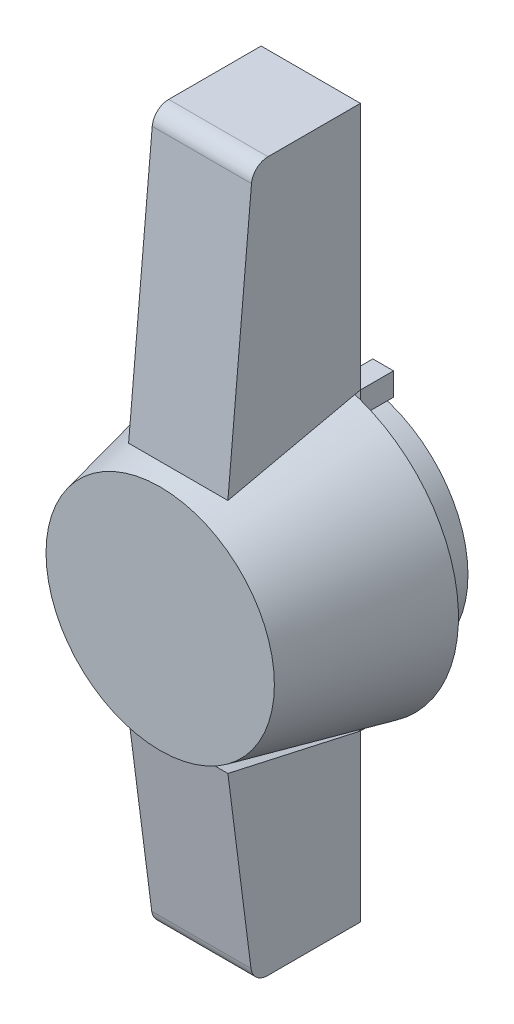
from build123d import *

# Parameters (mm, degrees)
CROQUIS1_R                = 14
SALIENTE_EXTRUIR1_DEPTH   = 2.5
SALIENTE_EXTRUIR2_DEPTH   = 6
SALIENTE_EXTRUIR2_2_DEPTH = 6
CROQUIS8_W                = 2.5
CROQUIS8_H                = 2.765808148
SALIENTE_EXTRUIR4_DEPTH   = 4


with BuildPart() as part:
    # Croquis1 → Saliente-Extruir1 (new, symmetric)
    with BuildSketch(Plane.XY):
        Circle(CROQUIS1_R)
    extrude(amount=SALIENTE_EXTRUIR1_DEPTH, both=True)

    # Croquis4 → Revolución1 (revolve)
    with BuildSketch(Plane(origin=(0, 0, 0), x_dir=(1, 0, 0), z_dir=(0, 1, 0)), mode=Mode.PRIVATE) as revoluci_n1_sk:
        Polygon((0, -2.5), (17.85, -2.5), (13.8, -20.7), (0, -20.7), align=None)
    revolve(revoluci_n1_sk.sketch.rotate(Axis((0, 0, 2.5), (0, 0, 1)), 180), axis=Axis((0, 0, 2.5), (0, 0, 1)))

    # Croquis8 → Saliente-Extruir4 (add)
    with BuildSketch(Plane(origin=(0, 0, 2.5), x_dir=(-1, 0, 0), z_dir=(0, 0, -1))):
        with Locations((-4.75, 16.467095926)):
            Rectangle(CROQUIS8_W, CROQUIS8_H)
        with Locations((4.75, 16.467095926)):
            Rectangle(CROQUIS8_W, CROQUIS8_H)
        with Locations((4.75, -16.467095926)):
            Rectangle(CROQUIS8_W, CROQUIS8_H)
        with Locations((-4.75, -16.467095926)):
            Rectangle(CROQUIS8_W, CROQUIS8_H)
    extrude(amount=SALIENTE_EXTRUIR4_DEPTH)


with BuildPart() as body_2:
    # Croquis6 → Saliente-Extruir2 (new, symmetric)
    with BuildSketch(Plane(origin=(0, 0, 0), x_dir=(0, 0, -1), z_dir=(1, 0, 0))):
        with BuildLine():
            Line((-2.5, 17.85), (-2.5, 47.85))
            Line((-2.5, 47.85), (-13.671870764, 47.85))
            ThreePointArc((-13.671870764, 47.85), (-15.021231375, 47.326220154), (-15.663824092, 46.029225942))
            Line((-15.663824092, 46.029225942), (-18.52, 14.28510989))
            Line((-18.52, 14.28510989), (-2.5, 17.85))
        make_face()
    extrude(amount=SALIENTE_EXTRUIR2_DEPTH, both=True)


with BuildPart() as body_3:
    # Croquis6 → Saliente-Extruir2 2 (new, symmetric)
    with BuildSketch(Plane(origin=(0, 0, 0), x_dir=(0, 0, -1), z_dir=(1, 0, 0))):
        with BuildLine():
            Line((-2.5, -17.85), (-18.52, -14.28510989))
            Line((-18.52, -14.28510989), (-15.723731687, -36.104234234))
            ThreePointArc((-15.723731687, -36.104234234), (-15.061230554, -37.351410748), (-13.739956257, -37.85))
            Line((-13.739956257, -37.85), (-2.5, -37.85))
            Line((-2.5, -37.85), (-2.5, -17.85))
        make_face()
    extrude(amount=SALIENTE_EXTRUIR2_2_DEPTH, both=True)


solid = Compound([part.part, body_2.part, body_3.part])
